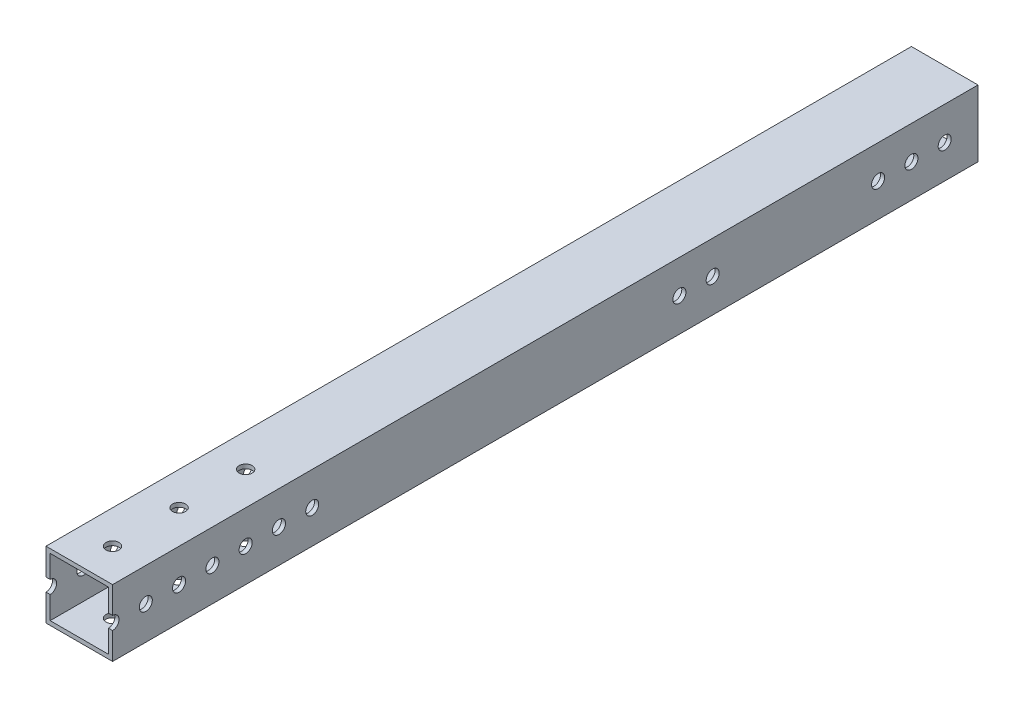
from build123d import *

# Parameters (mm, degrees)
SKETCH1_W           = 25.4
SKETCH1_H           = 25.4
SKETCH1_W_2         = 22.225
SKETCH1_H_2         = 22.225
BOSS_EXTRUDE1_DEPTH = 1016
SKETCH2_R           = 2.4892
CUT_EXTRUDE1_DEPTH  = 1017.634801686
SKETCH4_R           = 2.4892
CUT_EXTRUDE2_DEPTH  = 1017.634801686
SKETCH5_W           = 25.4
SKETCH5_H           = 685.827246856
CUT_EXTRUDE3_DEPTH  = 1017.634801686


with BuildPart() as part:
    # Sketch1 → Boss-Extrude1 (new body)
    with BuildSketch(Plane.XY):
        with Locations((12.7, 12.7)):
            Rectangle(SKETCH1_W, SKETCH1_H)
        with Locations((12.7, 12.7)):
            Rectangle(SKETCH1_W_2, SKETCH1_H_2, mode=Mode.SUBTRACT)
    extrude(amount=BOSS_EXTRUDE1_DEPTH)

    # Sketch2 → Cut-Extrude1 (cut, through all)
    with BuildSketch(Plane(origin=(0, 0, 0), x_dir=(-1, 0, 0), z_dir=(0, -1, 0))):
        with Locations((12.7, -1003.3)):
            Circle(SKETCH2_R)
        with Locations(Location((-12.7, -1003.3, 0), (0, 0, 90))):
            Circle(SKETCH2_R)
        with Locations(Location((-12.7, -977.9, 0), (0, 0, 90))):
            Circle(SKETCH2_R)
        with Locations(Location((-12.7, -952.5, 0), (0, 0, 90))):
            Circle(SKETCH2_R)
        with Locations(Location((-12.7, -927.1, 0), (0, 0, 90))):
            Circle(SKETCH2_R)
        with Locations(Location((-12.7, -901.7, 0), (0, 0, 90))):
            Circle(SKETCH2_R)
        with Locations(Location((-12.7, -876.3, 0), (0, 0, 90))):
            Circle(SKETCH2_R)
        with Locations(Location((-12.7, -850.9, 0), (0, 0, 90))):
            Circle(SKETCH2_R)
        with Locations(Location((-12.7, -825.5, 0), (0, 0, 90))):
            Circle(SKETCH2_R)
        with Locations(Location((-12.7, -800.1, 0), (0, 0, 90))):
            Circle(SKETCH2_R)
        with Locations(Location((-12.7, -774.7, 0), (0, 0, 90))):
            Circle(SKETCH2_R)
        with Locations(Location((-12.7, -749.3, 0), (0, 0, 90))):
            Circle(SKETCH2_R)
        with Locations(Location((-12.7, -723.9, 0), (0, 0, 90))):
            Circle(SKETCH2_R)
        with Locations((12.7, -977.9)):
            Circle(SKETCH2_R)
        with Locations((12.7, -952.5)):
            Circle(SKETCH2_R)
        with Locations((12.7, -927.1)):
            Circle(SKETCH2_R)
        with Locations((12.7, -901.7)):
            Circle(SKETCH2_R)
        with Locations((12.7, -876.3)):
            Circle(SKETCH2_R)
        with Locations((12.7, -850.9)):
            Circle(SKETCH2_R)
        with Locations((12.7, -825.5)):
            Circle(SKETCH2_R)
        with Locations((12.7, -800.1)):
            Circle(SKETCH2_R)
        with Locations((12.7, -774.7)):
            Circle(SKETCH2_R)
        with Locations((12.7, -749.3)):
            Circle(SKETCH2_R)
        with Locations((12.7, -723.9)):
            Circle(SKETCH2_R)
        with Locations((12.7, -698.5)):
            Circle(SKETCH2_R)
        with Locations(Location((-12.7, -698.5, 0), (0, 0, 90))):
            Circle(SKETCH2_R)
        with Locations((12.7, -673.1)):
            Circle(SKETCH2_R)
        with Locations(Location((-12.7, -673.1, 0), (0, 0, 90))):
            Circle(SKETCH2_R)
        with Locations((12.7, -647.7)):
            Circle(SKETCH2_R)
        with Locations(Location((-12.7, -647.7, 0), (0, 0, 90))):
            Circle(SKETCH2_R)
        with Locations((12.7, -622.3)):
            Circle(SKETCH2_R)
        with Locations(Location((-12.7, -622.3, 0), (0, 0, 90))):
            Circle(SKETCH2_R)
        with Locations((12.7, -596.9)):
            Circle(SKETCH2_R)
        with Locations(Location((-12.7, -596.9, 0), (0, 0, 90))):
            Circle(SKETCH2_R)
        with Locations((12.7, -571.5)):
            Circle(SKETCH2_R)
        with Locations(Location((-12.7, -571.5, 0), (0, 0, 90))):
            Circle(SKETCH2_R)
        with Locations((12.7, -546.1)):
            Circle(SKETCH2_R)
        with Locations(Location((-12.7, -546.1, 0), (0, 0, 90))):
            Circle(SKETCH2_R)
        with Locations((12.7, -520.7)):
            Circle(SKETCH2_R)
        with Locations(Location((-12.7, -520.7, 0), (0, 0, 90))):
            Circle(SKETCH2_R)
        with Locations((12.7, -495.3)):
            Circle(SKETCH2_R)
        with Locations(Location((-12.7, -495.3, 0), (0, 0, 90))):
            Circle(SKETCH2_R)
        with Locations((12.7, -469.9)):
            Circle(SKETCH2_R)
        with Locations(Location((-12.7, -469.9, 0), (0, 0, 90))):
            Circle(SKETCH2_R)
        with Locations((12.7, -444.5)):
            Circle(SKETCH2_R)
        with Locations(Location((-12.7, -444.5, 0), (0, 0, 90))):
            Circle(SKETCH2_R)
        with Locations((12.7, -419.1)):
            Circle(SKETCH2_R)
        with Locations(Location((-12.7, -419.1, 0), (0, 0, 90))):
            Circle(SKETCH2_R)
        with Locations((12.7, -393.7)):
            Circle(SKETCH2_R)
        with Locations(Location((-12.7, -393.7, 0), (0, 0, 90))):
            Circle(SKETCH2_R)
        with Locations((12.7, -368.3)):
            Circle(SKETCH2_R)
        with Locations(Location((-12.7, -368.3, 0), (0, 0, 90))):
            Circle(SKETCH2_R)
        with Locations((12.7, -342.9)):
            Circle(SKETCH2_R)
        with Locations(Location((-12.7, -342.9, 0), (0, 0, 90))):
            Circle(SKETCH2_R)
        with Locations((12.7, -317.5)):
            Circle(SKETCH2_R)
        with Locations(Location((-12.7, -317.5, 0), (0, 0, 90))):
            Circle(SKETCH2_R)
        with Locations((12.7, -292.1)):
            Circle(SKETCH2_R)
        with Locations(Location((-12.7, -292.1, 0), (0, 0, 90))):
            Circle(SKETCH2_R)
        with Locations((12.7, -266.7)):
            Circle(SKETCH2_R)
        with Locations(Location((-12.7, -266.7, 0), (0, 0, 90))):
            Circle(SKETCH2_R)
    extrude(amount=-CUT_EXTRUDE1_DEPTH, mode=Mode.SUBTRACT)

    # Sketch4 → Cut-Extrude2 (cut, through all)
    with BuildSketch(Plane(origin=(25.4, 0, 0), x_dir=(0, 0, -1), z_dir=(1, 0, 0))):
        with Locations((-1003.3, 12.7)):
            Circle(SKETCH4_R)
        with Locations((-990.6, 12.7)):
            Circle(SKETCH4_R)
        with Locations((-977.9, 12.7)):
            Circle(SKETCH4_R)
        with Locations((-965.2, 12.7)):
            Circle(SKETCH4_R)
        with Locations((-952.5, 12.7)):
            Circle(SKETCH4_R)
        with Locations((-939.8, 12.7)):
            Circle(SKETCH4_R)
        with Locations((-927.1, 12.7)):
            Circle(SKETCH4_R)
        with Locations((-914.4, 12.7)):
            Circle(SKETCH4_R)
        with Locations((-901.7, 12.7)):
            Circle(SKETCH4_R)
        with Locations((-889, 12.7)):
            Circle(SKETCH4_R)
        with Locations((-876.3, 12.7)):
            Circle(SKETCH4_R)
        with Locations((-863.6, 12.7)):
            Circle(SKETCH4_R)
        with Locations((-850.9, 12.7)):
            Circle(SKETCH4_R)
        with Locations((-838.2, 12.7)):
            Circle(SKETCH4_R)
        with Locations((-825.5, 12.7)):
            Circle(SKETCH4_R)
        with Locations((-812.8, 12.7)):
            Circle(SKETCH4_R)
        with Locations((-800.1, 12.7)):
            Circle(SKETCH4_R)
        with Locations((-787.4, 12.7)):
            Circle(SKETCH4_R)
        with Locations((-774.7, 12.7)):
            Circle(SKETCH4_R)
        with Locations((-762, 12.7)):
            Circle(SKETCH4_R)
        with Locations((-749.3, 12.7)):
            Circle(SKETCH4_R)
        with Locations((-736.6, 12.7)):
            Circle(SKETCH4_R)
        with Locations((-723.9, 12.7)):
            Circle(SKETCH4_R)
        with Locations((-711.2, 12.7)):
            Circle(SKETCH4_R)
        with Locations((-698.5, 12.7)):
            Circle(SKETCH4_R)
        with Locations((-685.8, 12.7)):
            Circle(SKETCH4_R)
        with Locations((-673.1, 12.7)):
            Circle(SKETCH4_R)
        with Locations((-660.4, 12.7)):
            Circle(SKETCH4_R)
        with Locations((-647.7, 12.7)):
            Circle(SKETCH4_R)
        with Locations((-635, 12.7)):
            Circle(SKETCH4_R)
        with Locations((-622.3, 12.7)):
            Circle(SKETCH4_R)
        with Locations((-609.6, 12.7)):
            Circle(SKETCH4_R)
        with Locations((-596.9, 12.7)):
            Circle(SKETCH4_R)
        with Locations((-113.914682, 12.7)):
            Circle(SKETCH4_R)
        with Locations((-101.214682, 12.7)):
            Circle(SKETCH4_R)
        with Locations((-584.2, 12.7)):
            Circle(SKETCH4_R)
        with Locations((-571.5, 12.7)):
            Circle(SKETCH4_R)
        with Locations((-558.8, 12.7)):
            Circle(SKETCH4_R)
        with Locations((-546.1, 12.7)):
            Circle(SKETCH4_R)
        with Locations((-533.4, 12.7)):
            Circle(SKETCH4_R)
        with Locations((-520.7, 12.7)):
            Circle(SKETCH4_R)
        with Locations((-508, 12.7)):
            Circle(SKETCH4_R)
        with Locations((-495.3, 12.7)):
            Circle(SKETCH4_R)
        with Locations((-482.6, 12.7)):
            Circle(SKETCH4_R)
        with Locations((-469.9, 12.7)):
            Circle(SKETCH4_R)
        with Locations((-457.2, 12.7)):
            Circle(SKETCH4_R)
        with Locations((-444.5, 12.7)):
            Circle(SKETCH4_R)
        with Locations((-431.8, 12.7)):
            Circle(SKETCH4_R)
        with Locations((-419.1, 12.7)):
            Circle(SKETCH4_R)
        with Locations((-406.4, 12.7)):
            Circle(SKETCH4_R)
        with Locations((-393.7, 12.7)):
            Circle(SKETCH4_R)
        with Locations((-381, 12.7)):
            Circle(SKETCH4_R)
        with Locations((-368.3, 12.7)):
            Circle(SKETCH4_R)
        with Locations((-355.6, 12.7)):
            Circle(SKETCH4_R)
        with Locations((-342.9, 12.7)):
            Circle(SKETCH4_R)
        with Locations((-330.2, 12.7)):
            Circle(SKETCH4_R)
        with Locations((-317.5, 12.7)):
            Circle(SKETCH4_R)
        with Locations((-304.8, 12.7)):
            Circle(SKETCH4_R)
        with Locations((-292.1, 12.7)):
            Circle(SKETCH4_R)
        with Locations((-279.4, 12.7)):
            Circle(SKETCH4_R)
        with Locations((-266.7, 12.7)):
            Circle(SKETCH4_R)
        with Locations((-254, 12.7)):
            Circle(SKETCH4_R)
        with Locations((-12.7, 12.7)):
            Circle(SKETCH4_R)
        with Locations((-25.4, 12.7)):
            Circle(SKETCH4_R)
        with Locations((-38.1, 12.7)):
            Circle(SKETCH4_R)
    extrude(amount=-CUT_EXTRUDE2_DEPTH, mode=Mode.SUBTRACT)

    # Sketch5 → Cut-Extrude3 (cut, through all)
    with BuildSketch(Plane(origin=(0, 25.4, 0), x_dir=(1, 0, 0), z_dir=(0, 1, 0))):
        with Locations((12.7, -673.086376572)):
            Rectangle(SKETCH5_W, SKETCH5_H)
    extrude(amount=-CUT_EXTRUDE3_DEPTH, mode=Mode.SUBTRACT)


solid = part.part
